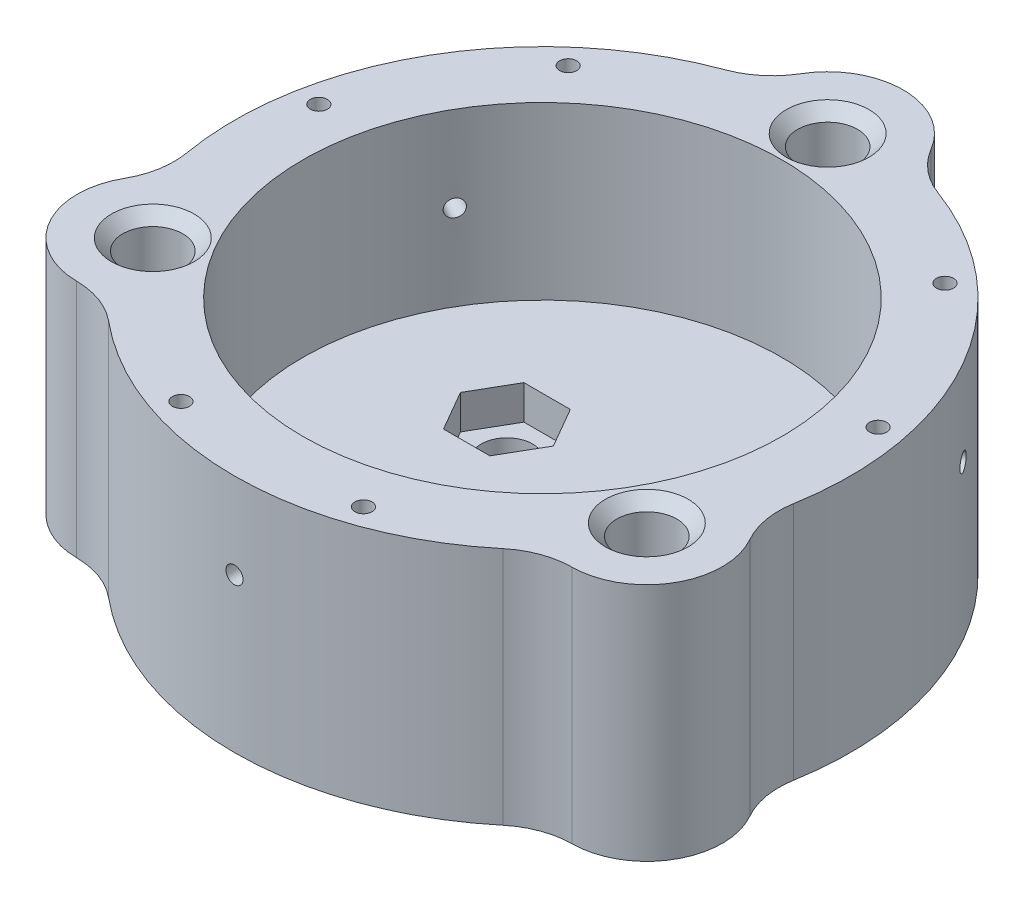
from build123d import *

# Parameters (mm, degrees)
SKETCH_1_R               = 2.625
SKETCH_1_R_2             = 21
EXTRUDE_1_DEPTH          = 15
EXTRUDE_START            = 6
EXTRUDE_2_DEPTH          = 6
FILLET_1_R               = 7
CHAMFER_1_SIZE           = 1
SKETCH_4_R               = 2.25
CUT_EXTRUDE_1_DEPTH      = 48.335527685
CUT_EXTRUDE_2_DEPTH      = 3
SKETCH_6_R               = 0.75
CUT_EXTRUDE_3_DEPTH      = 48.335527685
SKETCH_7_R               = 0.75
CUT_EXTRUDE_4_DEPTH      = 45.996135167
PATTERN_CIRCULAR_1_COUNT = 3


with BuildPart() as part:
    # Эскиз1 → Бобышка-Вытянуть1 (new body)
    with BuildSketch(Plane(origin=(0, 0, 0), x_dir=(1, 0, 0), z_dir=(0, 1, 0))):
        with BuildLine():
            ThreePointArc((25.949265582, -7.458928593), (23.382685902, 13.5), (6.515011145, 26.2021875))
            ThreePointArc((6.515011145, 26.2021875), (0, 31.625), (-6.515011145, 26.2021875))
            ThreePointArc((-6.515011145, 26.2021875), (-23.382685902, 13.5), (-25.949265582, -7.458928593))
            ThreePointArc((-25.949265582, -7.458928593), (-27.388053395, -15.8125), (-19.434254437, -18.743258907))
            ThreePointArc((-19.434254437, -18.743258907), (0, -27), (19.434254437, -18.743258907))
            ThreePointArc((19.434254437, -18.743258907), (27.388053395, -15.8125), (25.949265582, -7.458928593))
        make_face()
        with Locations(Location((0, 25, 0), (0, 0, 270))):
            Circle(SKETCH_1_R, mode=Mode.SUBTRACT)
        with Locations(Location((0, 0, 0), (0, 0, 270))):
            Circle(SKETCH_1_R_2, mode=Mode.SUBTRACT)
        with Locations(Location((-21.650635095, -12.5, 0), (0, 0, 270))):
            Circle(SKETCH_1_R, mode=Mode.SUBTRACT)
        with Locations(Location((21.650635095, -12.5, 0), (0, 0, 270))):
            Circle(SKETCH_1_R, mode=Mode.SUBTRACT)
    extrude(amount=EXTRUDE_1_DEPTH)

    # Эскиз2 → Бобышка-Вытянуть2 (add)
    with BuildSketch(Plane.XZ.offset(EXTRUDE_START)):
        with BuildLine():
            ThreePointArc((25.949265582, 7.458928593), (27.388053395, 15.8125), (19.434254437, 18.743258907))
            ThreePointArc((19.434254437, 18.743258907), (0, 27), (-19.434254437, 18.743258907))
            ThreePointArc((-19.434254437, 18.743258907), (-27.388053395, 15.8125), (-25.949265582, 7.458928593))
            ThreePointArc((-25.949265582, 7.458928593), (-23.382685902, -13.5), (-6.515011145, -26.2021875))
            ThreePointArc((-6.515011145, -26.2021875), (0, -31.625), (6.515011145, -26.2021875))
            ThreePointArc((6.515011145, -26.2021875), (23.382685902, -13.5), (25.949265582, 7.458928593))
        make_face()
    extrude(amount=-EXTRUDE_2_DEPTH)

    # Скругление1
    fillet_1_edges = [part.edges().sort_by_distance(p)[0] for p in [
        (19.434254437, 4.5, 18.743258907),
        (-19.434254437, 4.5, 18.743258907),
        (-25.949265582, 4.5, 7.458928593),
        (-6.515011145, 4.5, -26.2021875),
        (6.515011145, 4.5, -26.2021875),
        (25.949265582, 4.5, 7.458928593),
    ]]
    fillet(fillet_1_edges, radius=FILLET_1_R)

    # Фаска1
    chamfer_1_edges = [part.edges().sort_by_distance(p)[0] for p in [
        (21.650635095, 15, 9.875),
        (0, 15, -27.625),
        (-21.650635095, 15, 9.875),
    ]]
    chamfer(chamfer_1_edges, length=CHAMFER_1_SIZE)

    # Эскиз4 → Вырез-Вытянуть1 (cut, through all)
    with BuildSketch(Plane.XZ.offset(6)):
        with Locations(Location((0, 8.5, 0), (0, 0, 270))):
            Circle(SKETCH_4_R)
        with Locations(Location((7.361215932, -4.25, 0), (0, 0, 270))):
            Circle(SKETCH_4_R)
        with Locations(Location((-7.361215932, -4.25, 0), (0, 0, 270))):
            Circle(SKETCH_4_R)
    extrude(amount=-CUT_EXTRUDE_1_DEPTH, mode=Mode.SUBTRACT)

    # Эскиз5 → Вырез-Вытянуть2 (cut)
    with BuildSketch(Plane(origin=(0, 0, 0), x_dir=(1, 0, 0), z_dir=(0, 1, 0))):
        Polygon((2.035159699, -12.025), (4.070319398, -8.5), (2.035159699, -4.975), (-2.035159699, -4.975), (-4.070319398, -8.5), (-2.035159699, -12.025), align=None)
        Polygon((5.326056233, 0.725), (9.396375631, 0.725), (11.43153533, 4.25), (9.396375631, 7.775), (5.326056233, 7.775), (3.290896534, 4.25), align=None)
        Polygon((-11.43153533, 4.25), (-9.396375631, 0.725), (-5.326056233, 0.725), (-3.290896534, 4.25), (-5.326056233, 7.775), (-9.396375631, 7.775), align=None)
    extrude(amount=-CUT_EXTRUDE_2_DEPTH, mode=Mode.SUBTRACT)

    # Эскиз6 → Вырез-Вытянуть3 (cut, through all)
    with BuildSketch(Plane(origin=(0, 15, 0), x_dir=(1, 0, 0), z_dir=(0, 1, 0))):
        with Locations(Location((-8, -23.685438565, 0), (0, 0, 270))):
            Circle(SKETCH_6_R)
        with Locations(Location((8, -23.685438565, 0), (0, 0, 270))):
            Circle(SKETCH_6_R)
        with Locations(Location((-16.512191497, 18.770922513, 0), (0, 0, 270))):
            Circle(SKETCH_6_R)
        with Locations(Location((-24.512191497, 4.914516052, 0), (0, 0, 270))):
            Circle(SKETCH_6_R)
        with Locations(Location((24.512191497, 4.914516052, 0), (0, 0, 270))):
            Circle(SKETCH_6_R)
        with Locations(Location((16.512191497, 18.770922513, 0), (0, 0, 270))):
            Circle(SKETCH_6_R)
    extrude(amount=-CUT_EXTRUDE_3_DEPTH, mode=Mode.SUBTRACT)

    # Эскиз7 → Вырез-Вытянуть4 (cut, through all)
    with BuildSketch(Plane.XY):
        with Locations(Location((0, 7.5, 0), (0, 0, 270.000000034))):
            Circle(SKETCH_7_R)
    cut_extrude_4 = extrude(amount=CUT_EXTRUDE_4_DEPTH, mode=Mode.SUBTRACT)

    # Круговой массив1: Вырез-Вытянуть4 ×3 about axis
    pattern_circular_1_axis = Axis((0, 15, 0), (0, -1, 0))
    for i in range(1, PATTERN_CIRCULAR_1_COUNT):
        add(cut_extrude_4.rotate(pattern_circular_1_axis, i * 360 / PATTERN_CIRCULAR_1_COUNT), mode=Mode.SUBTRACT)


solid = part.part
